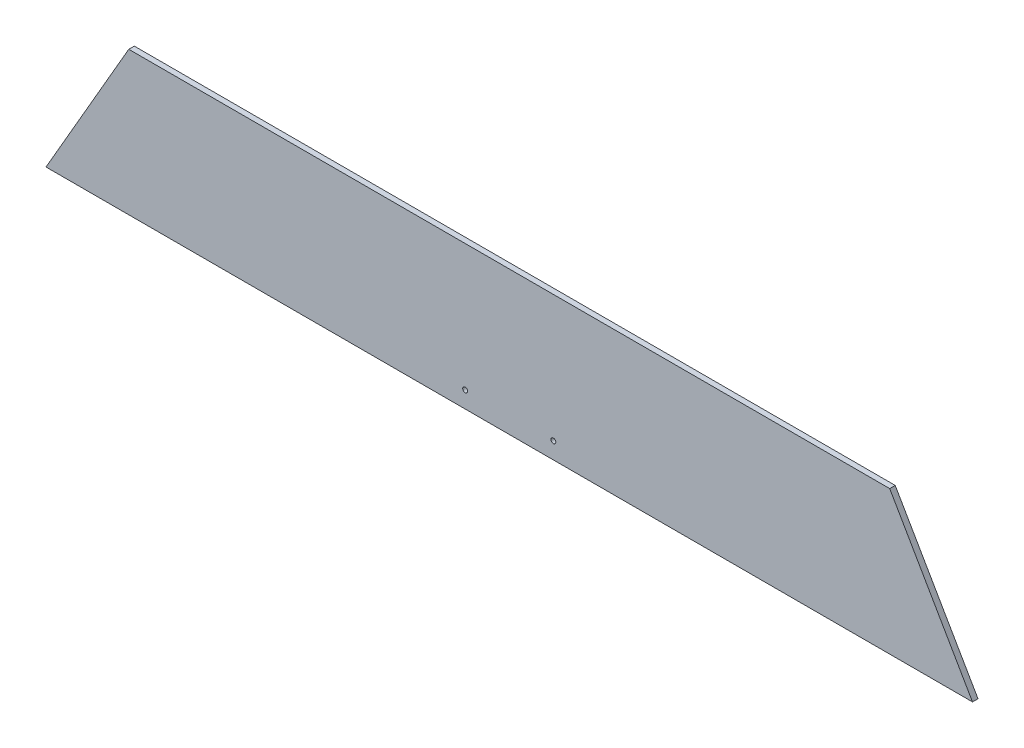
from build123d import *

# Parameters (mm, degrees)
BOSS_EXTRUDE1_DEPTH    = 6.35
F_10_CLEARANCE_HOLE1_D = 5.6134


with BuildPart() as part:
    # Sketch1 → Boss-Extrude1 (new body)
    with BuildSketch(Plane.XY):
        Polygon((-533.470529443, 0), (533.470529443, 0), (438.15, 165.1), (-438.15, 165.1), align=None)
    extrude(amount=BOSS_EXTRUDE1_DEPTH)

    # #10 Clearance Hole1 (through all)
    with Locations(Plane.XY.offset(6.35)):
        with Locations((-50.8, 19.05), (50.8, 19.05)):
            Hole(F_10_CLEARANCE_HOLE1_D / 2)


solid = part.part
